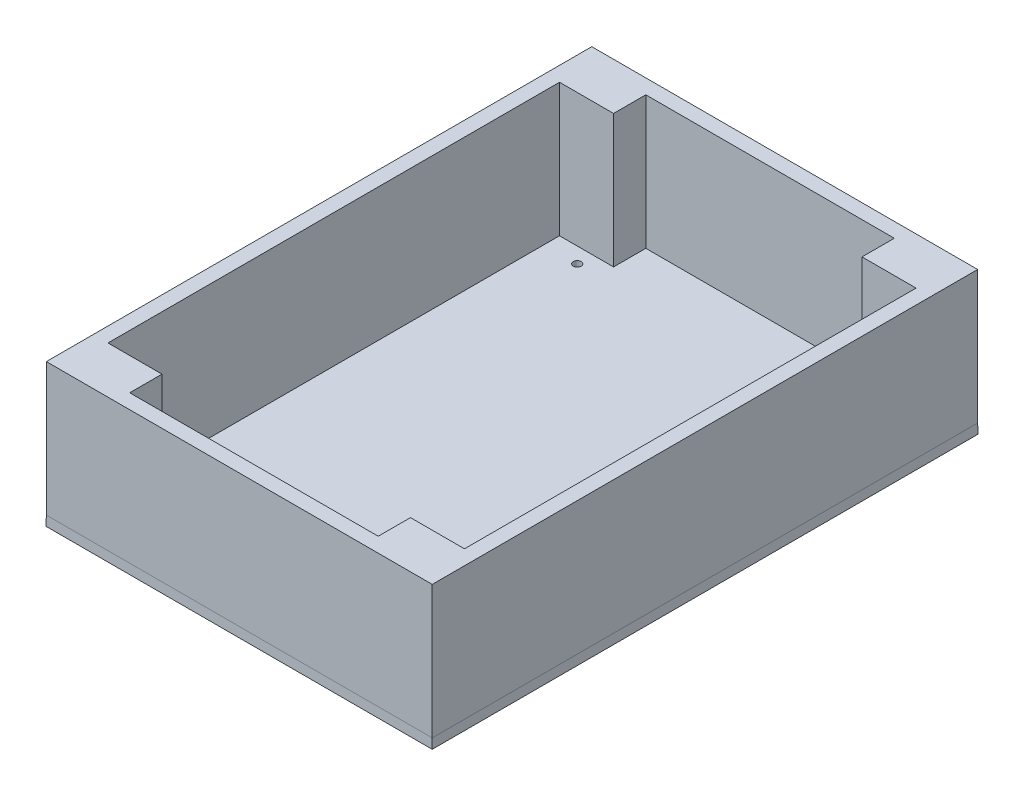
from build123d import *

# Parameters (mm, degrees)
SKETCH1_W             = 121.0056
SKETCH1_H             = 170.9928
BOSS_EXTRUDE1_DEPTH   = 3.048
BOSS_EXTRUDE1_TAPER   = 1
SKETCH2_W             = 120.899193924
SKETCH2_H             = 170.886393924
BOSS_EXTRUDE2_DEPTH   = 41.656
M3_TAPPED_HOLE1_D     = 2.5
M3_TAPPED_HOLE1_DEPTH = 4.7752
M3_TAPPED_HOLE1_TIP   = 0.751075774


with BuildPart() as part:
    # Sketch1 → Boss-Extrude1 (new body)
    with BuildSketch(Plane(origin=(0, 0, 0), x_dir=(1, 0, 0), z_dir=(0, 1, 0))):
        Rectangle(SKETCH1_W, SKETCH1_H)
    extrude(amount=BOSS_EXTRUDE1_DEPTH, taper=BOSS_EXTRUDE1_TAPER)

    # Sketch2 → Boss-Extrude2 (add)
    with BuildSketch(Plane(origin=(0, 3.048, 0), x_dir=(1, 0, 0), z_dir=(0, 1, 0))):
        Rectangle(SKETCH2_W, SKETCH2_H)
        Polygon((-55.852196962, 70.739), (-55.852196962, -70.739), (-38.9255, -70.739), (-38.9255, -80.845796962), (38.9255, -80.845796962), (38.9255, -70.739), (55.852196962, -70.739), (55.852196962, 70.739), (38.9255, 70.739), (38.9255, 80.845796962), (-38.9255, 80.845796962), (-38.9255, 70.739), align=None, mode=Mode.SUBTRACT)
    extrude(amount=BOSS_EXTRUDE2_DEPTH)

    # M3 Tapped Hole1
    with Locations(Plane(origin=(0, 3.048, 0), x_dir=(1, 0, 0), z_dir=(0, 1, 0))):
        with Locations((-45.466, 65.8876), (45.466, -65.8876), (45.466, 65.8876), (-45.466, -65.8876)):
            Hole(M3_TAPPED_HOLE1_D / 2, depth=M3_TAPPED_HOLE1_DEPTH)
            with Locations((0, 0, -(M3_TAPPED_HOLE1_DEPTH + M3_TAPPED_HOLE1_TIP / 2))):  # 118° drill point
                Cone(0, M3_TAPPED_HOLE1_D / 2, M3_TAPPED_HOLE1_TIP, mode=Mode.SUBTRACT)


solid = part.part
